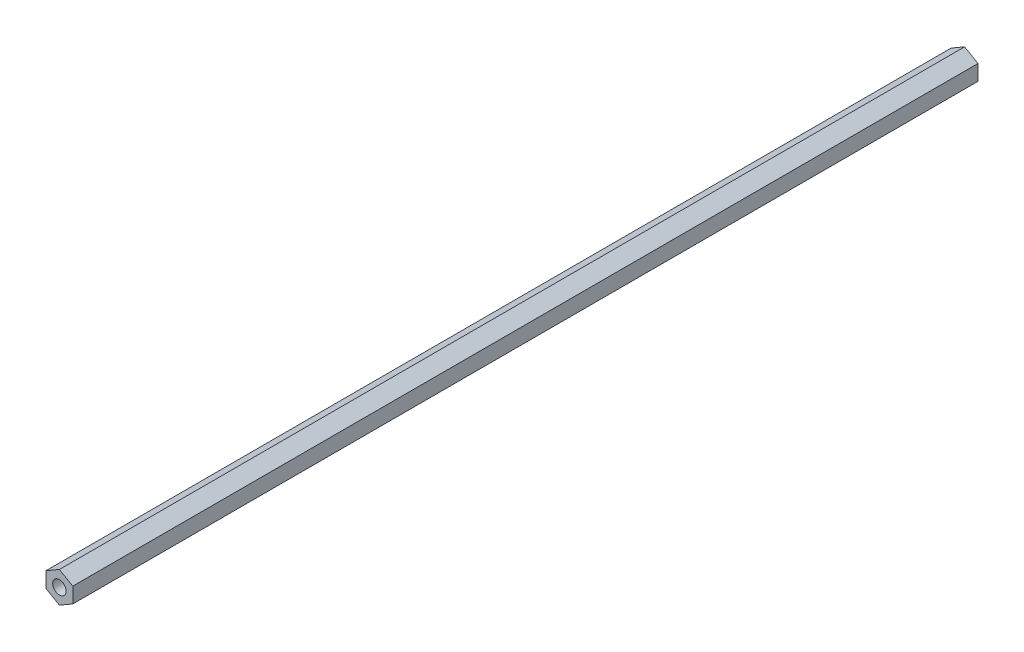
from build123d import *

# Parameters (mm, degrees)
BOSS_EXTRUDE2_DEPTH             = 214.629999
BOSS_EXTRUDE2_DEPTH_BACK        = 214.629999
F_1_4_0_25_DIAMETER_HOLE1_D     = 6.35
F_1_4_0_25_DIAMETER_HOLE1_DEPTH = 25.4
F_1_4_0_25_DIAMETER_HOLE1_TIP   = 1.907732465
F_1_4_0_25_DIAMETER_HOLE2_D     = 6.35
F_1_4_0_25_DIAMETER_HOLE2_DEPTH = 25.4
F_1_4_0_25_DIAMETER_HOLE2_TIP   = 1.907732465


with BuildPart() as part:
    # Sketch3 → Boss-Extrude2 (new, two sides: drawn at the far end of the back side and taken through both)
    with BuildSketch(Plane.XY.offset(-BOSS_EXTRUDE2_DEPTH_BACK)):
        Polygon((-6.35, -3.666174209), (0, -7.332348419), (6.35, -3.666174209), (6.35, 3.666174209), (0, 7.332348419), (-6.35, 3.666174209), align=None)
    extrude(amount=BOSS_EXTRUDE2_DEPTH + BOSS_EXTRUDE2_DEPTH_BACK)

    # 1/4 (0.25) Diameter Hole1
    with Locations(Plane.XY.offset(214.629999492)):
        with Locations((0, 0)):
            Hole(F_1_4_0_25_DIAMETER_HOLE1_D / 2, depth=F_1_4_0_25_DIAMETER_HOLE1_DEPTH)
            with Locations((0, 0, -(F_1_4_0_25_DIAMETER_HOLE1_DEPTH + F_1_4_0_25_DIAMETER_HOLE1_TIP / 2))):  # 118° drill point
                Cone(0, F_1_4_0_25_DIAMETER_HOLE1_D / 2, F_1_4_0_25_DIAMETER_HOLE1_TIP, mode=Mode.SUBTRACT)

    # 1/4 (0.25) Diameter Hole2
    with Locations(Plane(origin=(0, 0, -214.629999492), x_dir=(-1, 0, 0), z_dir=(0, 0, -1))):
        with Locations((0, 0)):
            Hole(F_1_4_0_25_DIAMETER_HOLE2_D / 2, depth=F_1_4_0_25_DIAMETER_HOLE2_DEPTH)
            with Locations((0, 0, -(F_1_4_0_25_DIAMETER_HOLE2_DEPTH + F_1_4_0_25_DIAMETER_HOLE2_TIP / 2))):  # 118° drill point
                Cone(0, F_1_4_0_25_DIAMETER_HOLE2_D / 2, F_1_4_0_25_DIAMETER_HOLE2_TIP, mode=Mode.SUBTRACT)


solid = part.part
